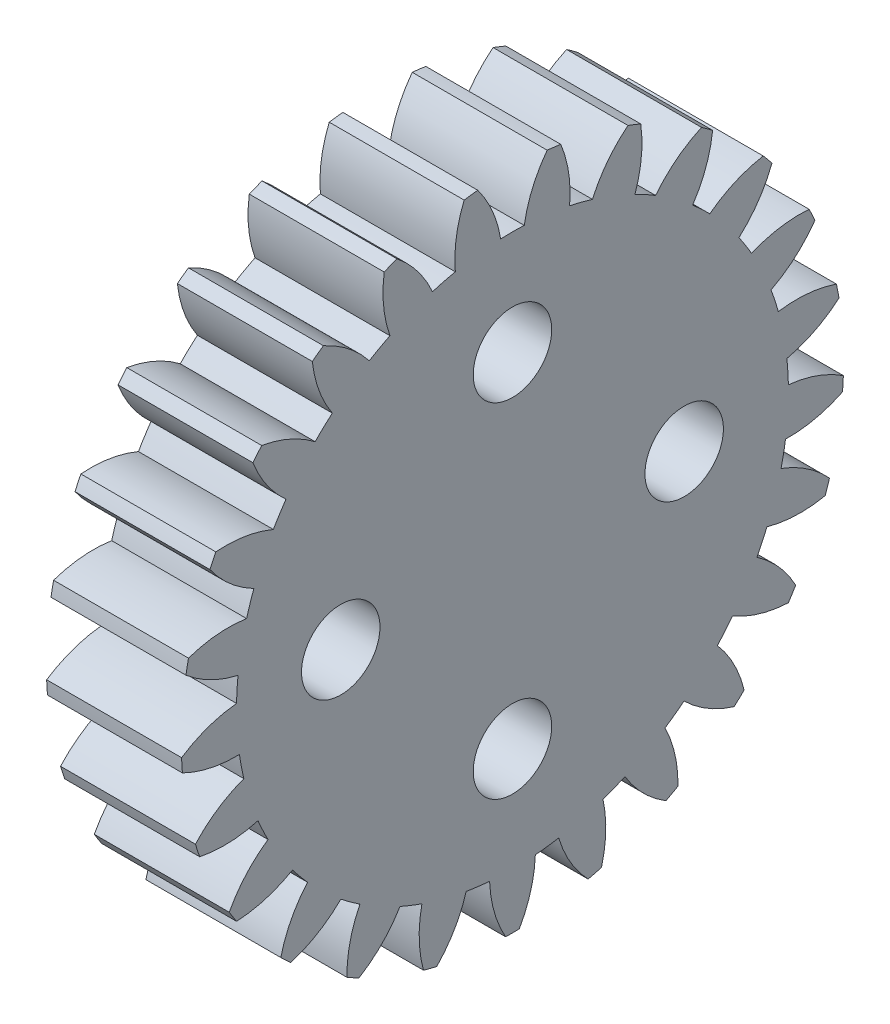
from build123d import *

# Parameters (mm, degrees)
BASPROSKE_W         = 5.5
BASPROSKE_H         = 13.5
TOOTHCUT_DEPTH      = 20.868316486
TEETHCUTS_COUNT     = 25
TEETHCUTS_ANGLE     = 345.6
BORSKE_R            = 7
BORE_DEPTH          = 50.0000508
EXTRUDE_START       = -5.5
SKETCH_1_R          = 7
EXTRUDE_1_DEPTH     = 5.5
SKETCH_2_R          = 1.6
CUT_EXTRUDE_1_DEPTH = 20.860181149


with BuildPart() as part:
    # BasProSke → Base-Revolve (revolve)
    with BuildSketch(Plane(origin=(0, 0, 0), x_dir=(1, 0, 0), z_dir=(0, 1, 0)), mode=Mode.PRIVATE) as base_revolve_sk:
        with Locations((2.75, 6.75)):
            Rectangle(BASPROSKE_W, BASPROSKE_H)
    revolve(base_revolve_sk.sketch.rotate(Axis((-10, 0, 0), (1, 0, 0)), 180), axis=Axis((-10, 0, 0), (1, 0, 0)))

    # TooCutSke → ToothCut (cut, through all)
    with BuildSketch(Plane(origin=(0, 0, 0), x_dir=(0, 0, -1), z_dir=(1, 0, 0))):
        with BuildLine():
            ThreePointArc((0.480087995, 11.238750665), (0, 11.249), (-0.480087995, 11.238750665))
            ThreePointArc((-0.480087995, 11.238750665), (-0.821124963, 12.40220054), (-1.432168974, 13.449361962))
            ThreePointArc((-1.432168974, 13.449361962), (0, 13.5254), (1.432168974, 13.449361962))
            ThreePointArc((1.432168974, 13.449361962), (0.821124963, 12.40220054), (0.480087995, 11.238750665))
        make_face()
    toothcut = extrude(amount=TOOTHCUT_DEPTH, mode=Mode.SUBTRACT)

    # TeethCuts: ToothCut ×25 about axis
    teethcuts_axis = Axis((-10, 0, 0), (1, 0, 0))
    for i in range(1, TEETHCUTS_COUNT):
        add(toothcut.rotate(teethcuts_axis, i * TEETHCUTS_ANGLE / (TEETHCUTS_COUNT - 1)), mode=Mode.SUBTRACT)

    # BorSke → Bore (cut, symmetric)
    with BuildSketch(Plane(origin=(0, 0, 0), x_dir=(0, 0, -1), z_dir=(1, 0, 0))):
        with Locations(Location((0, 0, 0), (0, 0, 180))):
            Circle(BORSKE_R)
    extrude(amount=BORE_DEPTH, both=True, mode=Mode.SUBTRACT)

    # ｽｹｯﾁ1 → ﾎﾞｽ - 押し出し1 (add)
    with BuildSketch(Plane.ZY.offset(EXTRUDE_START)):
        Circle(SKETCH_1_R)
    extrude(amount=EXTRUDE_1_DEPTH)

    # ｽｹｯﾁ2 → ｶｯﾄ - 押し出し1 (cut, through all)
    with BuildSketch(Plane(origin=(5.5, 0, 0), x_dir=(0, 0, -1), z_dir=(1, 0, 0))):
        with Locations((0, 7)):
            Circle(SKETCH_2_R)
        with Locations((7, 0)):
            Circle(SKETCH_2_R)
        with Locations((0, -7)):
            Circle(SKETCH_2_R)
        with Locations((-7, 0)):
            Circle(SKETCH_2_R)
    extrude(amount=-CUT_EXTRUDE_1_DEPTH, mode=Mode.SUBTRACT)


solid = part.part
